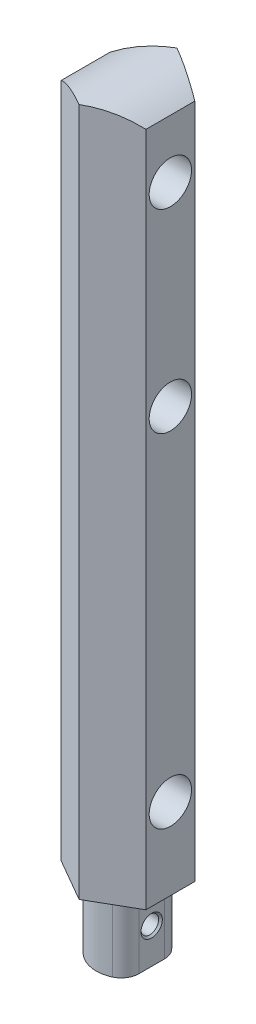
from build123d import *

# Parameters (mm, degrees)
EXTRUDE_1_DEPTH              = 195
EXTRUDE_2_DEPTH              = 20
CUT_EXTRUDE_5_DEPTH          = 20
CUT_EXTRUDE_5_DEPTH_BACK     = 20
HOLE_WIZARD_M6_1_D           = 5
HOLE_WIZARD_M6_1_CSINK_D     = 6.05
HOLE_WIZARD_M6_1_CSINK_ANGLE = 90
HOLE_WIZARD_1_D              = 6.5
HOLE_WIZARD_1_CBORE_D        = 12
HOLE_WIZARD_1_CBORE_DEPTH    = 15
HOLE_WIZARD_2_D              = 6.5
HOLE_WIZARD_2_CBORE_D        = 12
HOLE_WIZARD_2_CBORE_DEPTH    = 12


with BuildPart() as part:
    # 草图1 → 凸台-拉伸1 (new body)
    with BuildSketch(Plane(origin=(0, 0, 0), x_dir=(1, 0, 0), z_dir=(0, 1, 0))):
        Polygon((0, 13.856406461), (-12, 6.92820323), (-12, -6.92820323), (0, -13.856406461), (12, -6.92820323), (12, 6.92820323), align=None)
    extrude(amount=-EXTRUDE_1_DEPTH)

    # 草图3 → 凸台-拉伸2 (add)
    with BuildSketch(Plane.XZ.offset(195)):
        with BuildLine():
            Line((6.7, 3.620773398), (6.7, -3.620773398))
            ThreePointArc((6.7, -3.620773398), (5.920485754, -6.301724722), (3.825, -8.146740146))
            ThreePointArc((3.825, -8.146740146), (-9, 0), (3.825, 8.146740146))
            ThreePointArc((3.825, 8.146740146), (5.920485754, 6.301724722), (6.7, 3.620773398))
        make_face()
    extrude(amount=EXTRUDE_2_DEPTH)

    # 草图5 → 切除-拉伸5 (cut, two sides: drawn at the far end of the back side and taken through both)
    with BuildSketch(Plane.XY.offset(-CUT_EXTRUDE_5_DEPTH_BACK)):
        with BuildLine():
            ThreePointArc((0, 0), (6.258595844, -0.909007182), (12, -3.560911085))
            Line((12, -3.560911085), (25.347523703, 18.415156831))
            Line((25.347523703, 18.415156831), (-17.888682829, 19.552850293))
            Line((-17.888682829, 19.552850293), (-12, -3.560911085))
            ThreePointArc((-12, -3.560911085), (-6.258595844, -0.909007182), (0, 0))
        make_face()
    extrude(amount=CUT_EXTRUDE_5_DEPTH + CUT_EXTRUDE_5_DEPTH_BACK, mode=Mode.SUBTRACT)

    # M6 螺纹孔1 (through all)
    with Locations(Plane(origin=(6.7, 0, 0), x_dir=(0, 0, -1), z_dir=(1, 0, 0))):
        with Locations((0, -205)):
            CounterSinkHole(HOLE_WIZARD_M6_1_D / 2, HOLE_WIZARD_M6_1_CSINK_D / 2, counter_sink_angle=HOLE_WIZARD_M6_1_CSINK_ANGLE)

    # 孔1 (through all)
    with Locations(Plane(origin=(12, 0, 0), x_dir=(0, 0, -1), z_dir=(1, 0, 0))):
        with Locations((0, -172)):
            CounterBoreHole(HOLE_WIZARD_1_D / 2, HOLE_WIZARD_1_CBORE_D / 2, HOLE_WIZARD_1_CBORE_DEPTH)

    # 孔2 (through all)
    with Locations(Plane(origin=(12, 0, 0), x_dir=(0, 0, -1), z_dir=(1, 0, 0))):
        with Locations((0, -75), (0, -20)):
            CounterBoreHole(HOLE_WIZARD_2_D / 2, HOLE_WIZARD_2_CBORE_D / 2, HOLE_WIZARD_2_CBORE_DEPTH)


solid = part.part
